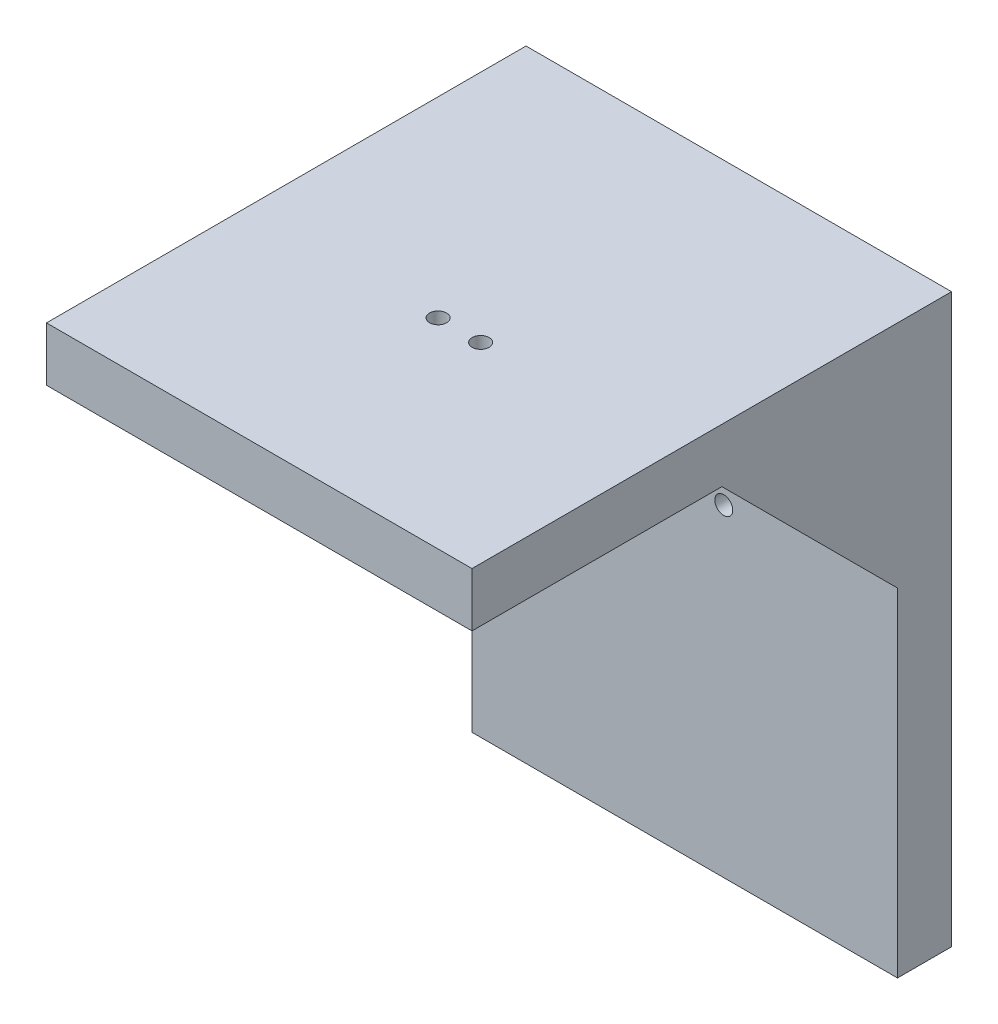
from build123d import *

# Parameters (mm, degrees)
SKETCH1_W           = 150
SKETCH1_H           = 200
PLATE_DEPTH         = 19.05
SKETCH2_W           = 150
SKETCH2_H           = 19.05
BOSS_EXTRUDE1_DEPTH = 150
BOSS_EXTRUDE2_DEPTH = 19.05
SKETCH4_R           = 3.175
CUT_EXTRUDE1_DEPTH  = 292.547594742
SKETCH6_R           = 3
CUT_EXTRUDE2_DEPTH  = 290.518229132


with BuildPart() as part:
    # Sketch1 → Plate (new body)
    with BuildSketch(Plane.XY):
        with Locations((75, 100)):
            Rectangle(SKETCH1_W, SKETCH1_H)
    extrude(amount=PLATE_DEPTH)

    # Sketch2 → Boss-Extrude1 (add)
    with BuildSketch(Plane.XY.offset(19.05)):
        with Locations((75, 190.475)):
            Rectangle(SKETCH2_W, SKETCH2_H)
    extrude(amount=BOSS_EXTRUDE1_DEPTH)

    # Sketch3 → Boss-Extrude2 (add)
    with BuildSketch(Plane.ZY):
        Polygon((0, 200), (0, 100), (100, 200), align=None)
    boss_extrude2 = extrude(amount=-BOSS_EXTRUDE2_DEPTH)

    # Mirror1: Boss-Extrude2 across plane
    add(boss_extrude2.mirror(Plane.ZY.offset(-75)))

    # Sketch4 → Cut-Extrude1 (cut, symmetric)
    with BuildSketch(Plane.XY.offset(19.05)):
        with Locations((61.25, 171.25)):
            Circle(SKETCH4_R)
        with Locations((61.25, 142.5)):
            Circle(SKETCH4_R)
        with Locations((61.25, 113.75)):
            Circle(SKETCH4_R)
    cut_extrude1 = extrude(amount=CUT_EXTRUDE1_DEPTH, both=True, mode=Mode.SUBTRACT)

    # Mirror2: Cut-Extrude1 across plane
    add(cut_extrude1.mirror(Plane.ZY.offset(-75)), mode=Mode.SUBTRACT)

    # Sketch6 → Cut-Extrude2 (cut, through all)
    with BuildSketch(Plane.XZ.offset(-180.95)):
        with Locations(Location((67.5, 98.5, 0), (0, 0, 270))):
            Circle(SKETCH6_R)
        with Locations(Location((82.5, 98.5, 0), (0, 0, 270))):
            Circle(SKETCH6_R)
    extrude(amount=-CUT_EXTRUDE2_DEPTH, mode=Mode.SUBTRACT)


solid = part.part
